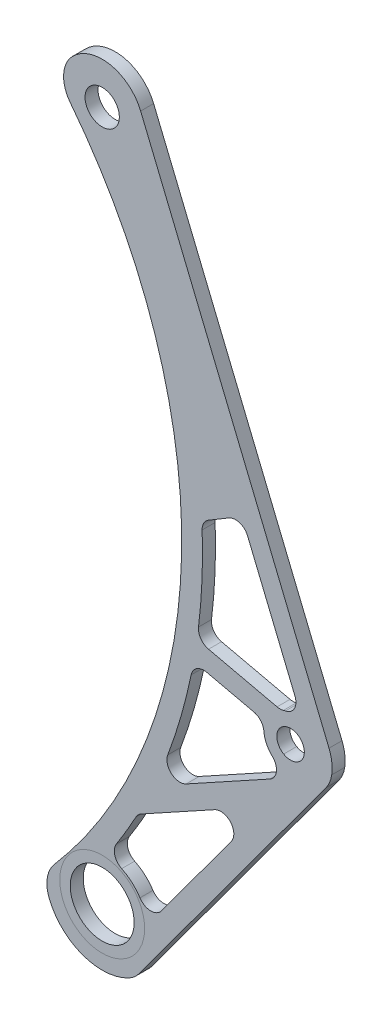
from build123d import *

# Parameters (mm, degrees)
SKETCH1_R           = 3.3655
SKETCH1_R_2         = 4.191
SKETCH1_R_3         = 7.8105
BOSS_EXTRUDE1_DEPTH = 3.175
CUT_EXTRUDE1_DEPTH  = 6.35
FILLET5_R           = 7.62
FILLET6_R           = 3.175


with BuildPart() as part:
    # Sketch1 → Boss-Extrude1 (new body)
    with BuildSketch(Plane.XY):
        with BuildLine():
            ThreePointArc((-13.97, 0), (-6.360706327, -12.437938536), (8.177790267, -11.326281223))
            Line((8.177790267, -11.326281223), (55.423036695, 52.988309562))
            ThreePointArc((55.423036695, 52.988309562), (56.188096936, 56.856216867), (55.423036695, 60.724124173))
            Line((55.423036695, 60.724124173), (9.394939759, 172.523907306))
            ThreePointArc((9.394939759, 172.523907306), (-1.971422335, 178.622899918), (-10.16, 168.656))
            ThreePointArc((-10.16, 168.656), (19.399795867, 83.617198889), (-13.97, 0))
        make_face()
        with Locations((46.028096936, 56.856216867)):
            Circle(SKETCH1_R, mode=Mode.SUBTRACT)
        with Locations((0, 168.656)):
            Circle(SKETCH1_R_2, mode=Mode.SUBTRACT)
        Circle(SKETCH1_R_3, mode=Mode.SUBTRACT)
    extrude(amount=BOSS_EXTRUDE1_DEPTH)

    # Sketch2 → Cut-Extrude1 (cut)
    with BuildSketch(Plane.XY.offset(3.175)):
        with BuildLine():
            ThreePointArc((24.342369565, 93.274569778), (24.372628405, 80.404838249), (23.166725616, 67.591692511))
            Line((23.166725616, 67.591692511), (43.590488936, 62.925500803))
            ThreePointArc((43.590488936, 62.925500803), (46.410316451, 63.385539075), (49.157207608, 62.599631066))
            Line((49.157207608, 62.599631066), (34.133316244, 99.091858815))
            Line((34.133316244, 99.091858815), (24.342369565, 93.274569778))
        make_face()
        with BuildLine():
            Line((39.723792881, 58.598023584), (22.350976776, 62.56716919))
            ThreePointArc((22.350976776, 62.56716919), (18.436727595, 46.655838158), (12.607589722, 31.342022385))
            Line((12.607589722, 31.342022385), (47.239535948, 50.428888047))
            ThreePointArc((47.239535948, 50.428888047), (41.214780777, 52.427884471), (39.723792881, 58.598023584))
        make_face()
        with BuildLine():
            Line((40.079895195, 40.682524127), (8.679618073, 23.376743294))
            ThreePointArc((8.679618073, 23.376743294), (5.069193292, 17.049607217), (1.119884547, 10.928269252))
            ThreePointArc((1.119884547, 10.928269252), (7.805850235, 7.729806748), (10.938708503, 1.012850693))
            Line((10.938708503, 1.012850693), (40.079895195, 40.682524127))
        make_face()
    extrude(amount=-CUT_EXTRUDE1_DEPTH, mode=Mode.SUBTRACT)

    # Fillet5
    fillet5_edges = [part.edges().sort_by_distance(p)[0] for p in [
        (-13.97, 0, 1.5875),
        (-10.16, 168.656, 1.5875),
        (55.423036695, 52.988309562, 1.5875),
        (8.177790267, -11.326281223, 1.5875),
    ]]
    fillet(fillet5_edges, radius=FILLET5_R)

    # Fillet6
    fillet6_edges = [part.edges().sort_by_distance(p)[0] for p in [
        (10.938708503, 1.012850693, 1.5875),
        (1.119884547, 10.928269252, 1.5875),
        (8.679618073, 23.376743294, 1.5875),
        (40.079895195, 40.682524127, 1.5875),
        (47.239535948, 50.428888047, 1.5875),
        (12.607589722, 31.342022385, 1.5875),
        (22.350976776, 62.56716919, 1.5875),
        (39.723792881, 58.598023584, 1.5875),
        (49.157207608, 62.599631066, 1.5875),
        (43.590488936, 62.925500803, 1.5875),
        (23.166725616, 67.591692511, 1.5875),
        (24.342369565, 93.274569778, 1.5875),
        (34.133316244, 99.091858815, 1.5875),
    ]]
    fillet(fillet6_edges, radius=FILLET6_R)


solid = part.part
